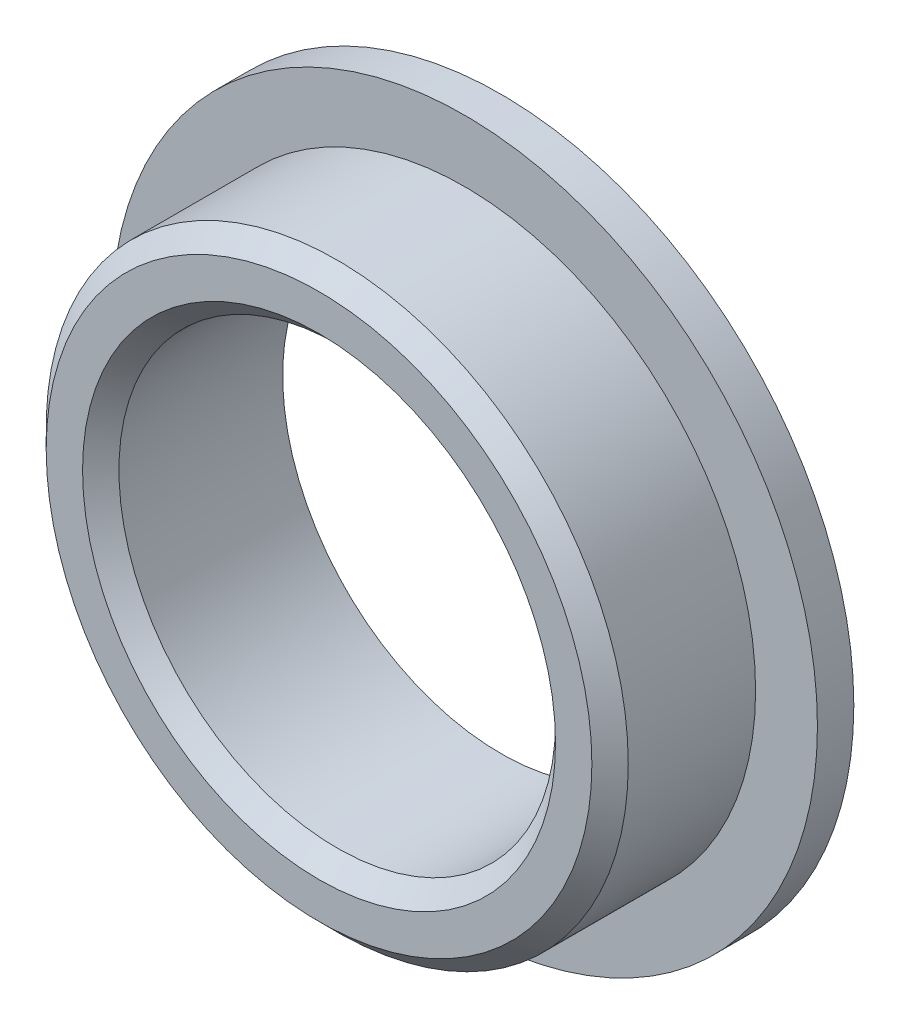
from build123d import *

# Parameters (mm, degrees)
SKETCH_1_R          = 4.85
EXTRUDE_1_DEPTH     = 0.5
SKETCH_2_R          = 4
EXTRUDE_2_DEPTH     = 2
SKETCH_3_R          = 3
CUT_EXTRUDE_3_DEPTH = 8.300342458
CHAMFER_1_SIZE      = 0.25


with BuildPart() as part:
    # 草圖1 → 伸長1 (new body)
    with BuildSketch(Plane.XY):
        Circle(SKETCH_1_R)
    extrude(amount=EXTRUDE_1_DEPTH)

    # 草圖2 → 伸長2 (add)
    with BuildSketch(Plane.XY.offset(0.5)):
        Circle(SKETCH_2_R)
    extrude(amount=EXTRUDE_2_DEPTH)

    # 草圖3 → 伸長3 (cut, through all)
    with BuildSketch(Plane.XY.offset(2.5)):
        Circle(SKETCH_3_R)
    extrude(amount=-CUT_EXTRUDE_3_DEPTH, mode=Mode.SUBTRACT)

    # 導角1
    chamfer_1_edges = [part.edges().sort_by_distance(p)[0] for p in [
        (-3, 0, 2.5),
        (-4, 0, 2.5),
    ]]
    chamfer(chamfer_1_edges, length=CHAMFER_1_SIZE)


solid = part.part
